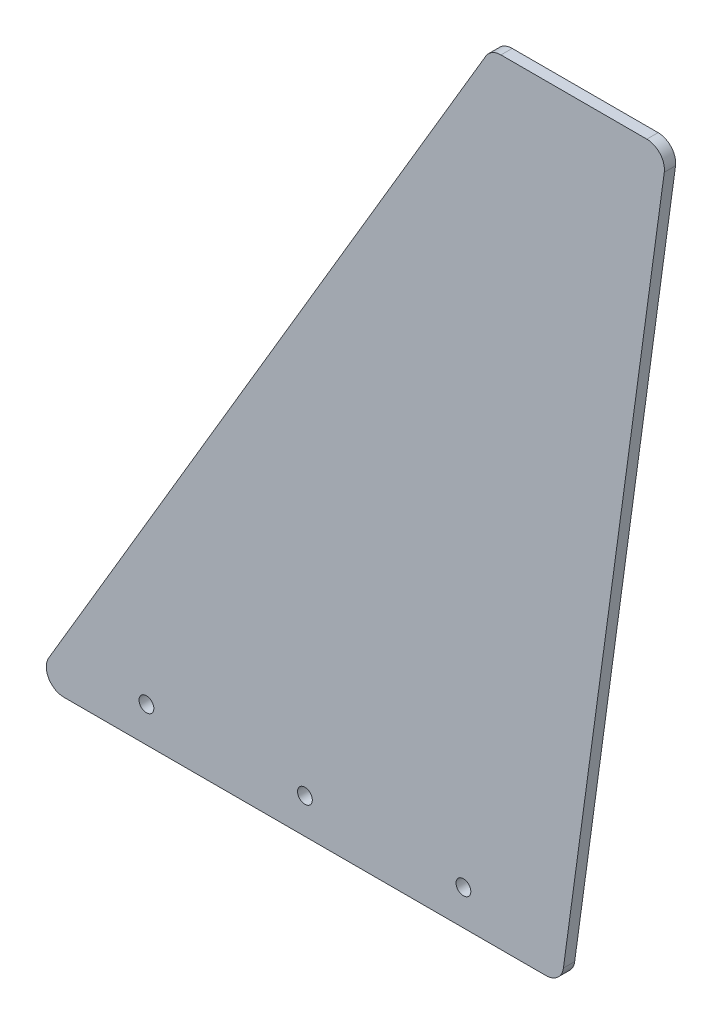
from build123d import *

# Parameters (mm, degrees)
EXTRUDE_1_DEPTH            = 3.2
FILLET_1_R                 = 5
SKETCH_2_R                 = 2.1
CUT_EXTRUDE_1_DEPTH        = 3.2
PATTERN_LINEAR_1_COUNT     = 2
PATTERN_LINEAR_1_PITCH     = 45
PATTERN_LINEAR_1_COL_COUNT = 2
PATTERN_LINEAR_1_COL_PITCH = 45


with BuildPart() as part:
    # Эскиз1 → Бобышка-Вытянуть1 (new body)
    with BuildSketch(Plane.XY):
        Polygon((0, 0), (150, 0), (180, 220), (130, 220), align=None)
    extrude(amount=EXTRUDE_1_DEPTH)

    # Скругление1
    fillet_1_edges = [part.edges().sort_by_distance(p)[0] for p in [
        (130, 220, 1.6),
        (180, 220, 1.6),
        (150, 0, 1.6),
        (0, 0, 1.6),
    ]]
    fillet(fillet_1_edges, radius=FILLET_1_R)

    # Эскиз2 → Вырез-Вытянуть1 (cut)
    with BuildSketch(Plane.XY.offset(3.2)):
        with Locations((77.198893337, 10)):
            Circle(SKETCH_2_R)
    cut_extrude_1 = extrude(amount=-CUT_EXTRUDE_1_DEPTH, mode=Mode.SUBTRACT)

    # Линейный массив1: Вырез-Вытянуть1 ×2
    with Locations(*[(i * PATTERN_LINEAR_1_PITCH, 0, 0) for i in range(1, PATTERN_LINEAR_1_COUNT)]):
        add(cut_extrude_1, mode=Mode.SUBTRACT)

    # Линейный массив1 col: Вырез-Вытянуть1 ×2
    with Locations(*[(-i * PATTERN_LINEAR_1_COL_PITCH, 0, 0) for i in range(1, PATTERN_LINEAR_1_COL_COUNT)]):
        add(cut_extrude_1, mode=Mode.SUBTRACT)


solid = part.part
